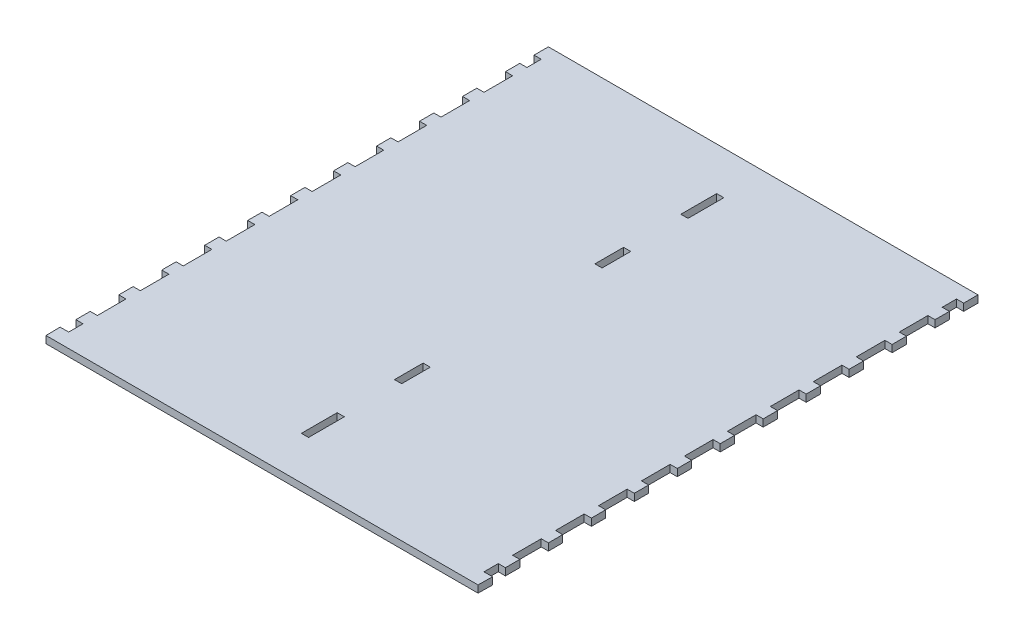
from build123d import *

# Parameters (mm, degrees)
SKETCH1_W           = 5
SKETCH1_H           = 25
SKETCH1_H_2         = 20
BOSS_EXTRUDE2_DEPTH = 5


with BuildPart() as part:
    # Sketch1 → Boss-Extrude2 (new body)
    with BuildSketch(Plane(origin=(0, 0, 0), x_dir=(1, 0, 0), z_dir=(0, 1, 0))):
        Polygon((-24.829979235, 345.545008259), (-19.829979235, 345.545008259), (-19.829979235, 335.545008259), (-24.829979235, 335.545008259), (-24.829979235, 325.545008259), (-19.829979235, 325.545008259), (-19.829979235, 315.545008259), (-19.829979235, 305.545008259), (-24.829979235, 305.545008259), (-24.829979235, 295.545008259), (-19.829979235, 295.545008259), (-19.829979235, 285.545008259), (-19.829979235, 275.545008259), (-24.829979235, 275.545008259), (-24.829979235, 265.545008259), (-19.829979235, 265.545008259), (-19.829979235, 255.545008259), (-19.829979235, 245.545008259), (-24.829979235, 245.545008259), (-24.829979235, 235.545008259), (-19.829979235, 235.545008259), (-19.829979235, 225.545008259), (-19.829979235, 215.545008259), (-24.829979235, 215.545008259), (-24.829979235, 205.545008259), (-19.829979235, 205.545008259), (-19.829979235, 195.545008259), (-19.829979235, 185.545008259), (-24.829979235, 185.545008259), (-24.829979235, 175.545008259), (-19.829979235, 175.545008259), (-19.829979235, 165.545008259), (-19.829979235, 155.545008259), (-24.829979235, 155.545008259), (-24.829979235, 145.545008259), (-19.829979235, 145.545008259), (-19.829979235, 135.545008259), (-19.829979235, 125.545008259), (-24.829979235, 125.545008259), (-24.829979235, 115.545008259), (-19.829979235, 115.545008259), (-19.829979235, 105.545008259), (-19.829979235, 95.545008259), (-24.829979235, 95.545008259), (-24.829979235, 85.545008259), (-19.829979235, 85.545008259), (-19.829979235, 75.545008259), (-19.829979235, 65.545008259), (-24.829979235, 65.545008259), (-24.829979235, 55.545008259), (-19.829979235, 55.545008259), (-19.829979235, 45.545008259), (-19.829979235, 35.545008259), (-24.829979235, 35.545008259), (-24.829979235, 25.545008259), (-19.829979235, 25.545008259), (-19.829979235, 15.545008259), (-25.820121993, 15.545008259), (-25.676959723, 5.546033083), (276.017001253, 5.546033083), (276.160163523, 15.545008259), (270.170020765, 15.545008259), (270.170020765, 25.545008259), (275.170020765, 25.545008259), (275.170020765, 35.545008259), (270.170020765, 35.545008259), (270.170020765, 45.545008259), (270.170020765, 55.545008259), (275.170020765, 55.545008259), (275.170020765, 65.545008259), (270.170020765, 65.545008259), (270.170020765, 75.545008259), (270.170020765, 85.545008259), (275.170020765, 85.545008259), (275.170020765, 95.545008259), (270.170020765, 95.545008259), (270.170020765, 105.545008259), (270.170020765, 115.545008259), (275.170020765, 115.545008259), (275.170020765, 125.545008259), (270.170020765, 125.545008259), (270.170020765, 135.545008259), (270.170020765, 145.545008259), (275.170020765, 145.545008259), (275.170020765, 155.545008259), (270.170020765, 155.545008259), (270.170020765, 165.545008259), (270.170020765, 175.545008259), (275.170020765, 175.545008259), (275.170020765, 185.545008259), (270.170020765, 185.545008259), (270.170020765, 195.545008259), (270.170020765, 205.545008259), (275.170020765, 205.545008259), (275.170020765, 215.545008259), (270.170020765, 215.545008259), (270.170020765, 225.545008259), (270.170020765, 235.545008259), (275.170020765, 235.545008259), (275.170020765, 245.545008259), (270.170020765, 245.545008259), (270.170020765, 255.545008259), (270.170020765, 265.545008259), (275.170020765, 265.545008259), (275.170020765, 275.545008259), (270.170020765, 275.545008259), (270.170020765, 285.545008259), (270.170020765, 295.545008259), (275.170020765, 295.545008259), (275.170020765, 305.545008259), (270.170020765, 305.545008259), (270.170020765, 315.545008259), (270.170020765, 325.545008259), (275.170020765, 325.545008259), (275.170020765, 335.545008259), (270.170020765, 335.545008259), (270.170020765, 345.545008259), (275.170020765, 345.545008259), (275.170020765, 355.545008259), (-24.829979235, 355.545008259), align=None)
        with Locations((125.170020765, 313.045008259)):
            Rectangle(SKETCH1_W, SKETCH1_H, mode=Mode.SUBTRACT)
        with Locations((125.170020765, 48.046033083)):
            Rectangle(SKETCH1_W, SKETCH1_H, mode=Mode.SUBTRACT)
        with Locations((125.170020765, 250.545008259)):
            Rectangle(SKETCH1_W, SKETCH1_H_2, mode=Mode.SUBTRACT)
        with Locations((125.170020765, 110.546033083)):
            Rectangle(SKETCH1_W, SKETCH1_H_2, mode=Mode.SUBTRACT)
    extrude(amount=BOSS_EXTRUDE2_DEPTH)


solid = part.part
